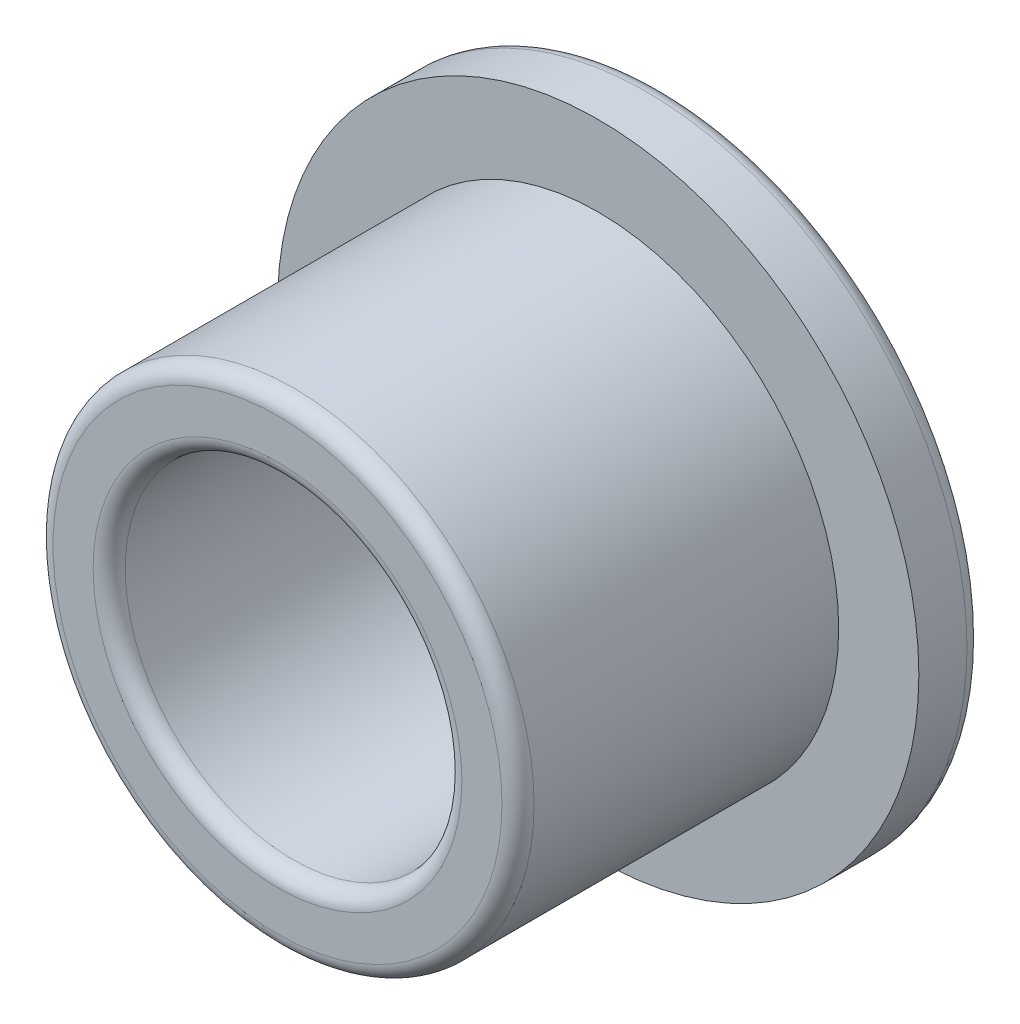
from build123d import *

# Parameters (mm, degrees)
SKICA1_R                = 7.5
SKICA1_R_2              = 5.25
P_IDAT_VYSUNUT_M1_DEPTH = 10
P_IDAT_START            = -2
SKICA1_3_R              = 10
SKICA1_3_R_2            = 5.25
P_IDAT_VYSUNUT_M2_DEPTH = 2
ZAOBLIT1_R              = 0.5


with BuildPart() as part:
    # Skica1 → Přidat vysunutím1 (new body)
    with BuildSketch(Plane.XY):
        Circle(SKICA1_R)
        Circle(SKICA1_R_2, mode=Mode.SUBTRACT)
    extrude(amount=P_IDAT_VYSUNUT_M1_DEPTH)

    # Skica1<3> → Přidat vysunutím2 (add)
    with BuildSketch(Plane.XY.offset(P_IDAT_START)):
        Circle(SKICA1_3_R)
        Circle(SKICA1_3_R_2, mode=Mode.SUBTRACT)
    extrude(amount=P_IDAT_VYSUNUT_M2_DEPTH)

    # Zaoblit1
    zaoblit1_edges = [part.edges().sort_by_distance(p)[0] for p in [
        (-7.5, 0, 10),
        (-5.25, 0, 10),
        (-5.25, 0, -2),
        (-10, 0, -2),
    ]]
    fillet(zaoblit1_edges, radius=ZAOBLIT1_R)


solid = part.part
